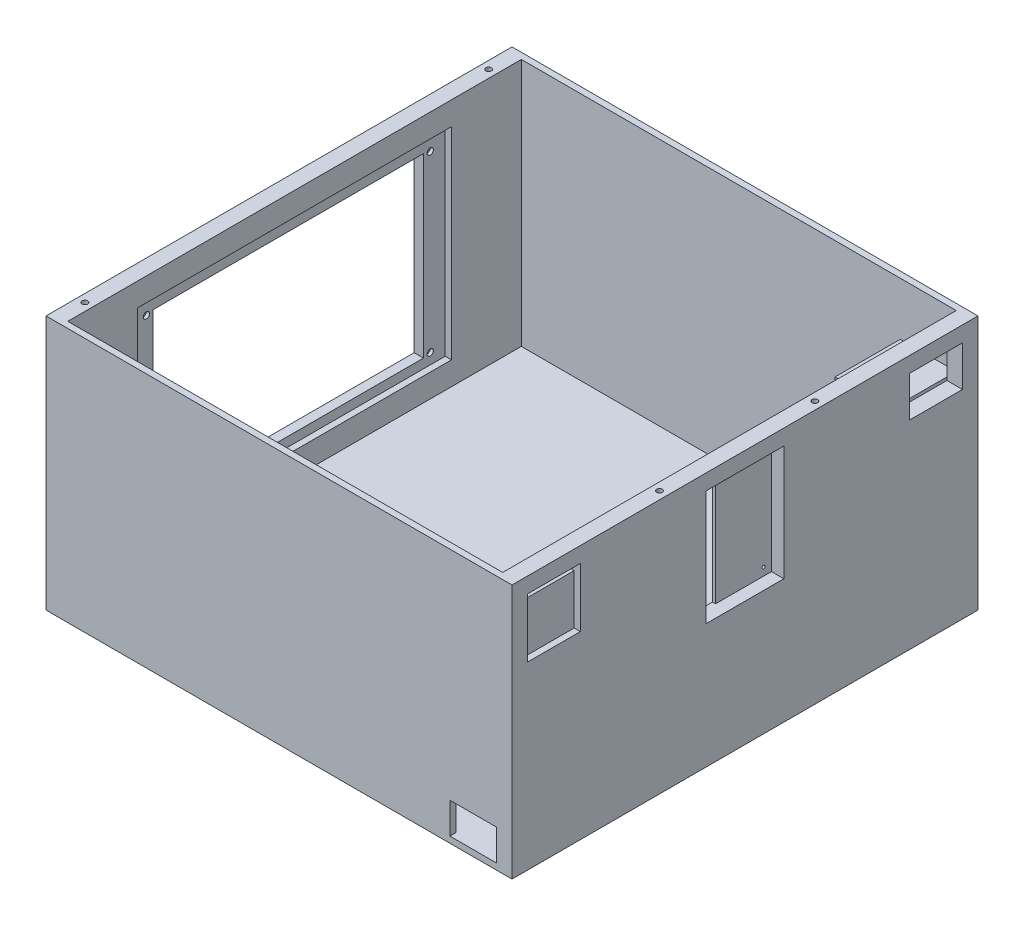
from build123d import *

# Parameters (mm, degrees)
SKIZZE1_W                        = 150
SKIZZE1_H                        = 150
AUFSATZ_LINEAR_AUSTRAGEN1_DEPTH  = 2
SKIZZE1_3_W                      = 150
SKIZZE1_3_H                      = 150
SKIZZE1_3_W_2                    = 140
SKIZZE1_3_H_2                    = 146
AUFSATZ_LINEAR_AUSTRAGEN2_DEPTH  = 80
SKIZZE2_W                        = 87
SKIZZE2_H                        = 57
SCHNITT_LINEAR_AUSTRAGEN1_DEPTH  = 10
SKIZZE5_W                        = 17
SKIZZE5_H                        = 13
SCHNITT_LINEAR_AUSTRAGEN3_DEPTH  = 10
SKIZZE6_W                        = 17
SKIZZE6_H                        = 19
SCHNITT_LINEAR_AUSTRAGEN4_DEPTH  = 2
SKIZZE7_W                        = 17
SKIZZE7_H                        = 3
SCHNITT_LINEAR_AUSTRAGEN5_DEPTH  = 10
SKIZZE9_W                        = 18
SKIZZE9_H                        = 21
AUFSATZ_LINEAR_AUSTRAGEN3_DEPTH  = 63
SKIZZE10_W                       = 15
SKIZZE10_H                       = 10
SCHNITT_LINEAR_AUSTRAGEN6_DEPTH  = 63
SKIZZE11_W                       = 101
SKIZZE11_H                       = 65
SCHNITT_LINEAR_AUSTRAGEN7_DEPTH  = 2
SKIZZE17_R                       = 1
SCHNITT_LINEAR_AUSTRAGEN10_DEPTH = 1
SKIZZE18_W                       = 7
SKIZZE18_H                       = 7
SCHNITT_LINEAR_AUSTRAGEN11_DEPTH = 4.5
SKIZZE19_R                       = 0.9
SCHNITT_LINEAR_AUSTRAGEN12_DEPTH = 15
SKIZZE20_W                       = 25
SKIZZE20_H                       = 37
SCHNITT_LINEAR_AUSTRAGEN13_DEPTH = 4
SKIZZE21_W                       = 7
SKIZZE21_H                       = 37
SCHNITT_LINEAR_AUSTRAGEN14_DEPTH = 3
SKIZZE24_R                       = 0.5
SCHNITT_LINEAR_AUSTRAGEN15_DEPTH = 6


with BuildPart() as part:
    # Skizze1 → Aufsatz-Linear austragen1 (new body)
    with BuildSketch(Plane(origin=(0, 0, 0), x_dir=(1, 0, 0), z_dir=(0, 1, 0))):
        with Locations((-0.733702775, 32.058376742)):
            Rectangle(SKIZZE1_W, SKIZZE1_H)
    extrude(amount=-AUFSATZ_LINEAR_AUSTRAGEN1_DEPTH)

    # Skizze1<3> → Aufsatz-Linear austragen2 (add)
    with BuildSketch(Plane(origin=(0, 0, 0), x_dir=(1, 0, 0), z_dir=(0, 1, 0))):
        with Locations((-0.733702775, 32.058376742)):
            Rectangle(SKIZZE1_3_W, SKIZZE1_3_H)
        with Locations((-0.733702775, 32.058376742)):
            Rectangle(SKIZZE1_3_W_2, SKIZZE1_3_H_2, mode=Mode.SUBTRACT)
    extrude(amount=AUFSATZ_LINEAR_AUSTRAGEN2_DEPTH)

    # Skizze2 → Schnitt-Linear austragen1 (cut)
    with BuildSketch(Plane.ZY.offset(75.733702775)):
        with Locations((-32.058376742, 39)):
            Rectangle(SKIZZE2_W, SKIZZE2_H)
    extrude(amount=-SCHNITT_LINEAR_AUSTRAGEN1_DEPTH, mode=Mode.SUBTRACT)

    # Skizze5 → Schnitt-Linear austragen3 (cut)
    with BuildSketch(Plane(origin=(74.266297225, 0, 0), x_dir=(0, 0, -1), z_dir=(1, 0, 0))):
        with Locations((93.558376742, 68.5)):
            Rectangle(SKIZZE5_W, SKIZZE5_H)
    extrude(amount=-SCHNITT_LINEAR_AUSTRAGEN3_DEPTH, mode=Mode.SUBTRACT)

    # Skizze6 → Schnitt-Linear austragen4 (cut)
    with BuildSketch(Plane(origin=(74.266297225, 0, 0), x_dir=(0, 0, -1), z_dir=(1, 0, 0))):
        with Locations((-29.441623258, 65.5)):
            Rectangle(SKIZZE6_W, SKIZZE6_H)
    extrude(amount=-SCHNITT_LINEAR_AUSTRAGEN4_DEPTH, mode=Mode.SUBTRACT)

    # Skizze7 → Schnitt-Linear austragen5 (cut)
    with BuildSketch(Plane(origin=(72.266297225, 0, 0), x_dir=(0, 0, -1), z_dir=(1, 0, 0))):
        with Locations((-29.441623258, 73.5)):
            Rectangle(SKIZZE7_W, SKIZZE7_H)
    extrude(amount=-SCHNITT_LINEAR_AUSTRAGEN5_DEPTH, mode=Mode.SUBTRACT)

    # Skizze9 → Aufsatz-Linear austragen3 (add)
    with BuildSketch(Plane(origin=(0, 0, 0), x_dir=(1, 0, 0), z_dir=(0, 1, 0))):
        with Locations((60.266297225, 94.558376742)):
            Rectangle(SKIZZE9_W, SKIZZE9_H)
    extrude(amount=AUFSATZ_LINEAR_AUSTRAGEN3_DEPTH)

    # Skizze10 → Schnitt-Linear austragen6 (cut)
    with BuildSketch(Plane(origin=(0, 0, 40.941623258), x_dir=(-1, 0, 0), z_dir=(0, 0, -1))):
        with Locations((-61.766297225, 5)):
            Rectangle(SKIZZE10_W, SKIZZE10_H)
    extrude(amount=-SCHNITT_LINEAR_AUSTRAGEN6_DEPTH, mode=Mode.SUBTRACT)

    # Skizze11 → Schnitt-Linear austragen7 (cut)
    with BuildSketch(Plane(origin=(-70.733702775, 0, 0), x_dir=(0, 0, -1), z_dir=(1, 0, 0))):
        with Locations((32.058376742, 40)):
            Rectangle(SKIZZE11_W, SKIZZE11_H)
    extrude(amount=-SCHNITT_LINEAR_AUSTRAGEN7_DEPTH, mode=Mode.SUBTRACT)

    # Skizze17 → Schnitt-Linear austragen10 (cut)
    with BuildSketch(Plane(origin=(-72.733702775, 0, 0), x_dir=(0, 0, -1), z_dir=(1, 0, 0))):
        with Locations((77.758376742, 67)):
            Circle(SKIZZE17_R)
        with Locations((77.758376742, 11)):
            Circle(SKIZZE17_R)
        with Locations((-13.641623258, 11)):
            Circle(SKIZZE17_R)
        with Locations((-13.641623258, 67)):
            Circle(SKIZZE17_R)
    extrude(amount=-SCHNITT_LINEAR_AUSTRAGEN10_DEPTH, mode=Mode.SUBTRACT)

    # Skizze18 → Schnitt-Linear austragen11 (cut)
    with BuildSketch(Plane.ZY.offset(75.733702775)):
        with Locations((27.191623258, 57.5)):
            Rectangle(SKIZZE18_W, SKIZZE18_H)
        Polygon((30.691623258, 31), (27.191623258, 31), (23.691623258, 31), (23.691623258, 24), (30.691623258, 24), align=None)
        with Locations((27.191623258, 37.5)):
            Rectangle(SKIZZE18_W, SKIZZE18_H)
        with Locations((27.191623258, 47.5)):
            Rectangle(SKIZZE18_W, SKIZZE18_H)
        with Locations((-91.518407477, 57.5)):
            Rectangle(SKIZZE18_W, SKIZZE18_H)
        with Locations((-91.518407477, 47.5)):
            Rectangle(SKIZZE18_W, SKIZZE18_H)
        with Locations((-91.518407477, 37.5)):
            Rectangle(SKIZZE18_W, SKIZZE18_H)
        with Locations((-91.518407477, 27.5)):
            Rectangle(SKIZZE18_W, SKIZZE18_H)
    extrude(amount=-SCHNITT_LINEAR_AUSTRAGEN11_DEPTH, mode=Mode.SUBTRACT)

    # Skizze19 → Schnitt-Linear austragen12 (cut)
    with BuildSketch(Plane(origin=(0, 80, 0), x_dir=(1, 0, 0), z_dir=(0, 1, 0))):
        with Locations((-73.233702775, -32.941623258)):
            Circle(SKIZZE19_R)
        with Locations((-73.233702775, 97.058376742)):
            Circle(SKIZZE19_R)
        with Locations((71.766297225, 7.058376742)):
            Circle(SKIZZE19_R)
        with Locations((71.766297225, 57.058376742)):
            Circle(SKIZZE19_R)
    extrude(amount=-SCHNITT_LINEAR_AUSTRAGEN12_DEPTH, mode=Mode.SUBTRACT)

    # Skizze20 → Schnitt-Linear austragen13 (cut)
    with BuildSketch(Plane(origin=(74.266297225, 0, 0), x_dir=(0, 0, -1), z_dir=(1, 0, 0))):
        with Locations((32.058376742, 56.476963809)):
            Rectangle(SKIZZE20_W, SKIZZE20_H)
    extrude(amount=-SCHNITT_LINEAR_AUSTRAGEN13_DEPTH, mode=Mode.SUBTRACT)

    # Skizze21 → Schnitt-Linear austragen14 (cut)
    with BuildSketch(Plane(origin=(70.266297225, 0, 0), x_dir=(0, 0, -1), z_dir=(1, 0, 0))):
        with Locations((23.058376742, 56.476963809)):
            Rectangle(SKIZZE21_W, SKIZZE21_H)
    extrude(amount=-SCHNITT_LINEAR_AUSTRAGEN14_DEPTH, mode=Mode.SUBTRACT)

    # Skizze24 → Schnitt-Linear austragen15 (cut)
    with BuildSketch(Plane(origin=(70.266297225, 0, 0), x_dir=(0, 0, -1), z_dir=(1, 0, 0))):
        with Locations((42.058376742, 40.476963809)):
            Circle(SKIZZE24_R)
    extrude(amount=-SCHNITT_LINEAR_AUSTRAGEN15_DEPTH, mode=Mode.SUBTRACT)


solid = part.part
